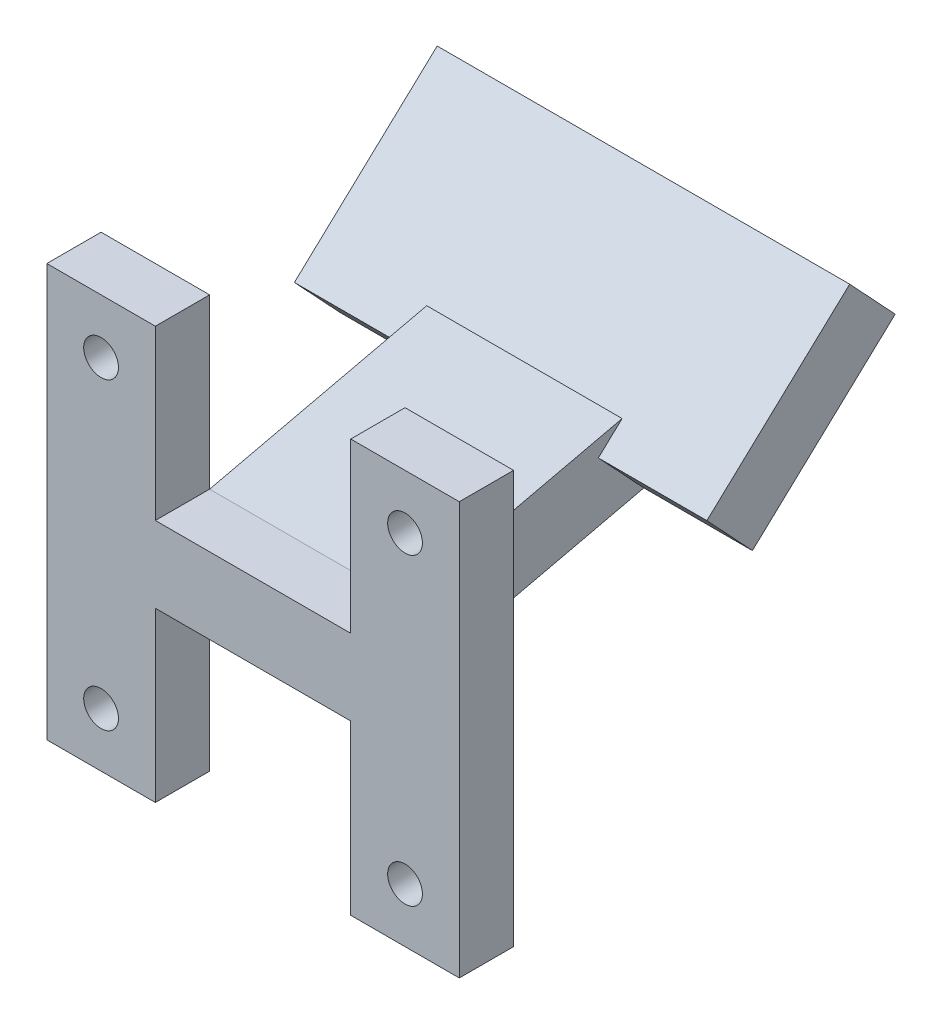
from build123d import *

# Parameters (mm, degrees)
SKETCH_1_R          = 1.6
EXTRUDE_1_DEPTH     = 5
EXTRUDE_START       = -10
EXTRUDE_2_DEPTH     = 18
SKETCH_4_W          = 10
SKETCH_4_H          = 18
EXTRUDE_3_DEPTH     = 6.14228691
SKETCH_5_R          = 2
CUT_EXTRUDE_1_DEPTH = 5


with BuildPart() as part:
    # 草图1 → 凸台-拉伸1 (new body)
    with BuildSketch(Plane.XY):
        Polygon((0, 0), (0, 38), (10, 38), (10, 22.5), (28, 22.5), (28, 38), (38, 38), (38, 0), (28, 0), (28, 15.5), (10, 15.5), (10, 0), align=None)
        with Locations((5, 33)):
            Circle(SKETCH_1_R, mode=Mode.SUBTRACT)
        with Locations((33, 33)):
            Circle(SKETCH_1_R, mode=Mode.SUBTRACT)
        with Locations((33, 5)):
            Circle(SKETCH_1_R, mode=Mode.SUBTRACT)
        with Locations((5, 5)):
            Circle(SKETCH_1_R, mode=Mode.SUBTRACT)
    extrude(amount=EXTRUDE_1_DEPTH)

    # 草图2 → 凸台-拉伸2 (add)
    with BuildSketch(Plane(origin=(38, 0, 0), x_dir=(0, 0, -1), z_dir=(1, 0, 0)).offset(EXTRUDE_START)):
        Polygon((0, 22.5), (20, 27.133580113), (30.962428796, 37.371995756), (35.154914556, 32.883036896), (22, 20.596938124), (0, 15.5), align=None)
    extrude(amount=-EXTRUDE_2_DEPTH)

    # 草图4 → 凸台-拉伸3 (add)
    with BuildSketch(Plane(origin=(0, 0.026666642, 0.024905444), x_dir=(1, 0, 0), z_dir=(0, -0.7308285864179805, -0.682561042892353))):
        with Locations((5, -39.136896468)):
            Rectangle(SKETCH_4_W, SKETCH_4_H)
        with Locations((33, -39.136896468)):
            Rectangle(SKETCH_4_W, SKETCH_4_H)
    extrude(amount=-EXTRUDE_3_DEPTH)

    # 草图5 → 切除-拉伸1 (cut)
    with BuildSketch(Plane(origin=(0, 0.026666642, 0.024905444), x_dir=(1, 0, 0), z_dir=(0, -0.7308285864179805, -0.682561042892353))):
        with Locations(Location((5, -43.136896468, 0), (0, 0, 270))):
            Circle(SKETCH_5_R)
        with Locations(Location((33, -43.136896468, 0), (0, 0, 270))):
            Circle(SKETCH_5_R)
    extrude(amount=-CUT_EXTRUDE_1_DEPTH, mode=Mode.SUBTRACT)


solid = part.part
